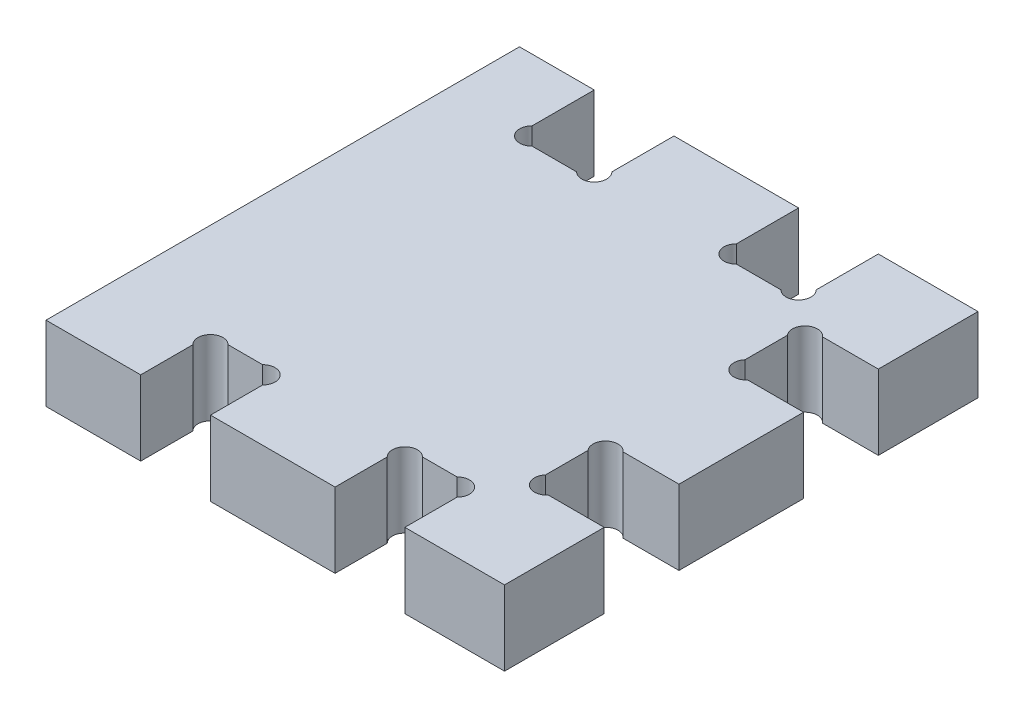
from build123d import *

# Parameters (mm, degrees)
BOSS_EXTRUDE1_DEPTH = 19.05


with BuildPart() as part:
    # Sketch1 → Boss-Extrude1 (new body)
    with BuildSketch(Plane(origin=(0, 0, 0), x_dir=(1, 0, 0), z_dir=(0, 1, 0))):
        with BuildLine():
            Line((-38.689871939, 17.78), (-29.890128061, 17.78))
            ThreePointArc((-29.890128061, 17.78), (-25.4, 17.78), (-25.4, 13.289871939))
            Line((-25.4, 13.289871939), (-25.4, 0))
            Line((-25.4, 0), (0, 0))
            Line((0, 0), (0, 25.4))
            Line((0, 25.4), (-14.2218161, 25.4))
            ThreePointArc((-14.2218161, 25.4), (-18.698135768, 25.048136767), (-19.05, 29.524456356))
            Line((-19.05, 29.524456356), (-19.05, 40.325543644))
            ThreePointArc((-19.05, 40.325543644), (-18.698136331, 44.801863892), (-14.2218161, 44.45))
            Line((-14.2218161, 44.45), (0, 44.45))
            Line((0, 44.45), (0, 76.2))
            Line((0, 76.2), (-14.2218161, 76.2))
            ThreePointArc((-14.2218161, 76.2), (-18.698136228, 75.848136228), (-19.05, 80.324456356))
            Line((-19.05, 80.324456356), (-19.05, 91.125543644))
            ThreePointArc((-19.05, 91.125543644), (-18.698136228, 95.601863772), (-14.2218161, 95.25))
            Line((-14.2218161, 95.25), (0, 95.25))
            Line((0, 95.25), (0, 120.65))
            Line((0, 120.65), (-25.4, 120.65))
            Line((-25.4, 120.65), (-25.4, 104.820128061))
            ThreePointArc((-25.4, 104.820128061), (-25.4, 100.33), (-29.890128061, 100.33))
            Line((-29.890128061, 100.33), (-41.229871939, 100.33))
            ThreePointArc((-41.229871939, 100.33), (-45.72, 100.33), (-45.72, 104.820128061))
            Line((-45.72, 104.820128061), (-45.72, 120.65))
            Line((-45.72, 120.65), (-77.47, 120.65))
            Line((-77.47, 120.65), (-77.47, 104.820128061))
            ThreePointArc((-77.47, 104.820128061), (-77.47, 100.33), (-81.960128061, 100.33))
            Line((-81.960128061, 100.33), (-93.299871939, 100.33))
            ThreePointArc((-93.299871939, 100.33), (-97.79, 100.33), (-97.79, 104.820128061))
            Line((-97.79, 104.820128061), (-97.79, 120.65))
            Line((-97.79, 120.65), (-116.84, 120.65))
            Line((-116.84, 120.65), (-116.84, 0))
            Line((-116.84, 0), (-92.71, 0))
            Line((-92.71, 0), (-92.71, 13.289871939))
            ThreePointArc((-92.71, 13.289871939), (-92.71, 17.78), (-88.219871939, 17.78))
            Line((-88.219871939, 17.78), (-79.420128061, 17.78))
            ThreePointArc((-79.420128061, 17.78), (-74.93, 17.78), (-74.93, 13.289871939))
            Line((-74.93, 13.289871939), (-74.93, 0))
            Line((-74.93, 0), (-43.18, 0))
            Line((-43.18, 0), (-43.18, 13.289871939))
            ThreePointArc((-43.18, 13.289871939), (-43.18, 17.78), (-38.689871939, 17.78))
        make_face()
    extrude(amount=BOSS_EXTRUDE1_DEPTH)


solid = part.part
